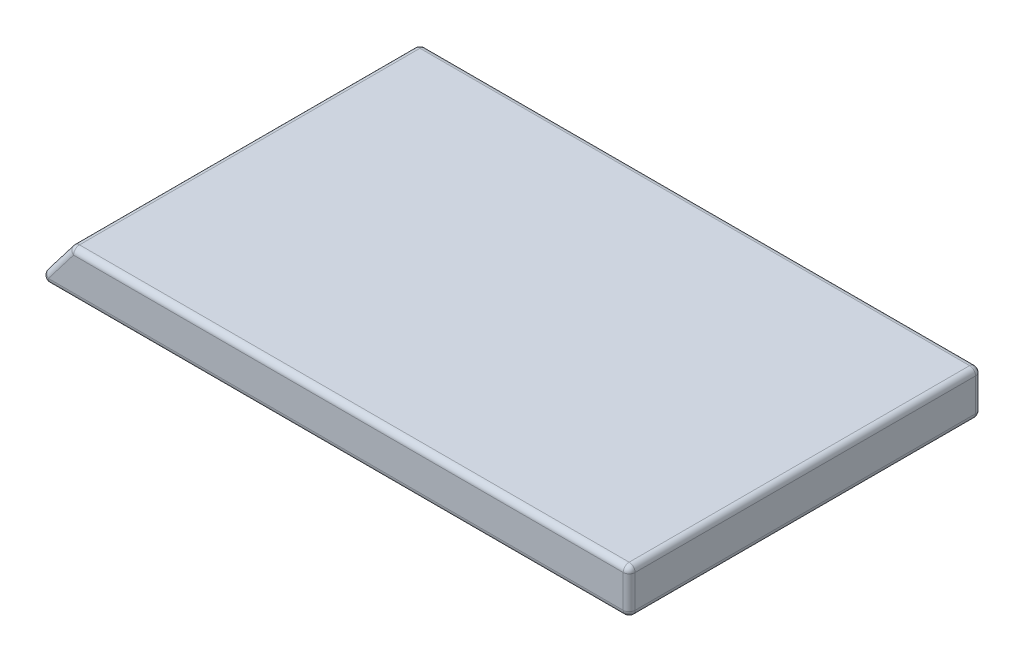
from build123d import *

# Parameters (mm, degrees)
BOSS_EXTRUDE1_DEPTH = 296
FILLET1_R           = 10


with BuildPart() as part:
    # Sketch1 → Boss-Extrude1 (new, symmetric)
    with BuildSketch(Plane.XY):
        Polygon((0, 0), (-996, 0), (-938.450475902, 75), (0, 75), align=None)
    extrude(amount=BOSS_EXTRUDE1_DEPTH, both=True)

    # Fillet1
    fillet1_edges = [part.edges().sort_by_distance(p)[0] for p in [
        (-967.225237951, 37.5, 296),
        (-498, 0, 296),
        (0, 37.5, 296),
        (-498, 0, -296),
        (-967.225237951, 37.5, -296),
        (-469.225237951, 75, -296),
        (0, 37.5, -296),
        (0, 0, 0),
        (-996, 0, 0),
        (-938.450475902, 75, 0),
        (0, 75, 0),
        (-469.225237951, 75, 296),
    ]]
    fillet(fillet1_edges, radius=FILLET1_R)


solid = part.part
